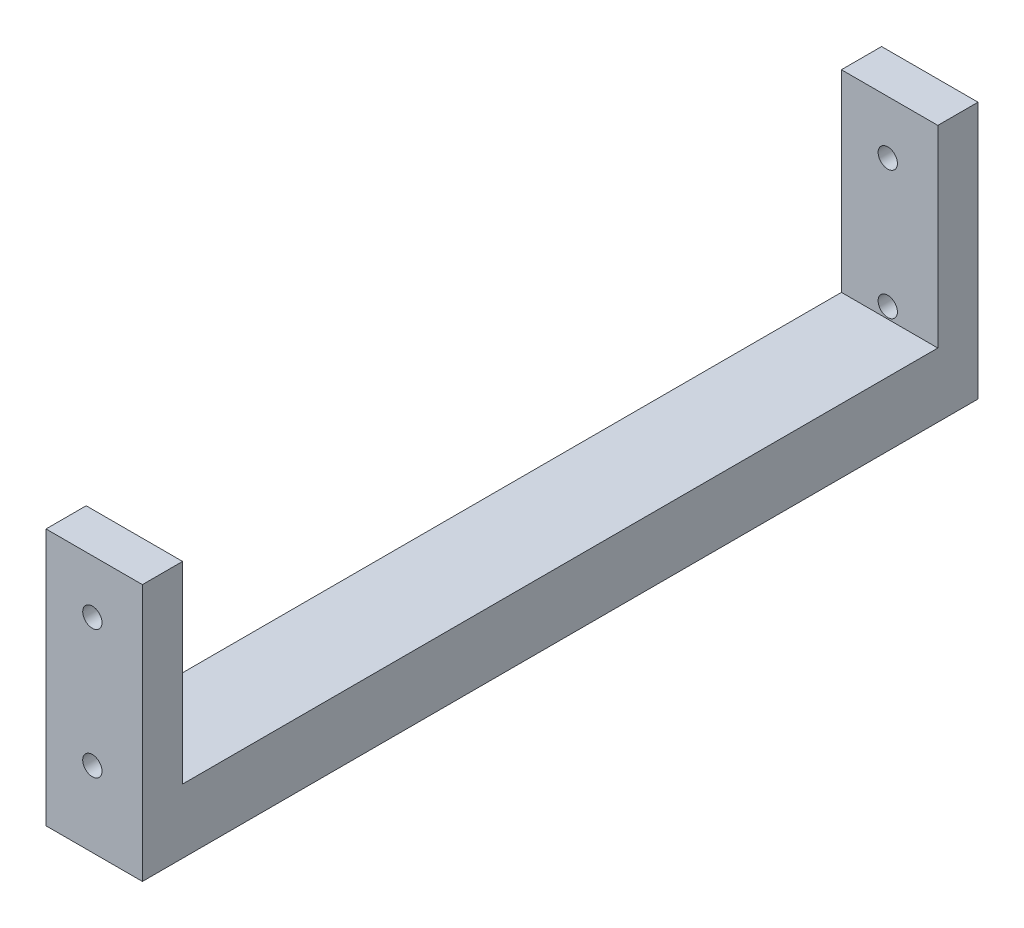
from build123d import *

# Parameters (mm, degrees)
SKETCH1_W               = 15
SKETCH1_H               = 40
BOSS_EXTRUDE1_DEPTH     = 130
SKETCH2_W               = 15
SKETCH2_H               = 117.5
CUT_EXTRUDE1_DEPTH      = 30
CUT_EXTRUDE2_DEPTH      = 133.594306062
CUT_EXTRUDE2_DEPTH_BACK = 133.594306062
SKETCH3_R               = 1.5


with BuildPart() as part:
    # Sketch1 → Boss-Extrude1 (new body)
    with BuildSketch(Plane.XY):
        with Locations((0, 5)):
            Rectangle(SKETCH1_W, SKETCH1_H)
    extrude(amount=BOSS_EXTRUDE1_DEPTH)

    # Sketch2 → Cut-Extrude1 (cut)
    with BuildSketch(Plane(origin=(0, 25, 0), x_dir=(1, 0, 0), z_dir=(0, 1, 0))):
        with Locations((0, -65)):
            Rectangle(SKETCH2_W, SKETCH2_H)
    extrude(amount=-CUT_EXTRUDE1_DEPTH, mode=Mode.SUBTRACT)

    # Sketch3 → Cut-Extrude2 (cut, two sides: drawn at the far end of the back side and taken through both)
    with BuildSketch(Plane(origin=(0, 0, 0), x_dir=(-1, 0, 0), z_dir=(0, 0, -1)).offset(-CUT_EXTRUDE2_DEPTH_BACK)):
        with Locations((0.28935703, 16.716588701)):
            Circle(SKETCH3_R)
        with Locations((0.28935703, -3.283411299)):
            Circle(SKETCH3_R)
    extrude(amount=CUT_EXTRUDE2_DEPTH + CUT_EXTRUDE2_DEPTH_BACK, mode=Mode.SUBTRACT)


solid = part.part
